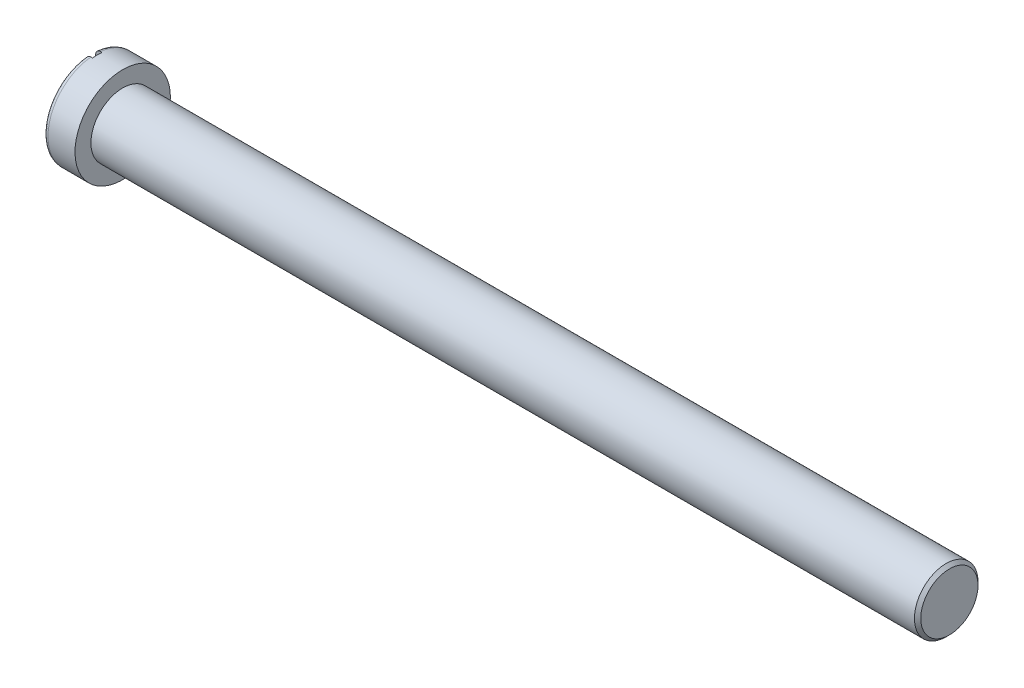
from build123d import *

# Parameters (mm, degrees)
SKETCH1_R           = 15
SKETCH1_R_2         = 10
BOSS_EXTRUDE1_DEPTH = 10
SKETCH1_2_R         = 10
BOSS_EXTRUDE2_DEPTH = 270
CHAMFER1_SIZE       = 1
FILLET1_R           = 1.5
SKETCH2_W           = 3
SKETCH2_H           = 32.549334764
CUT_EXTRUDE1_DEPTH  = 2


with BuildPart() as part:
    # Sketch1 → Boss-Extrude1 (new body)
    with BuildSketch(Plane(origin=(0, 0, 0), x_dir=(0, 0, -1), z_dir=(1, 0, 0))):
        Circle(SKETCH1_R)
        Circle(SKETCH1_R_2, mode=Mode.SUBTRACT)
    extrude(amount=BOSS_EXTRUDE1_DEPTH)

    # Sketch1<2> → Boss-Extrude2 (add)
    with BuildSketch(Plane(origin=(0, 0, 0), x_dir=(0, 0, -1), z_dir=(1, 0, 0))):
        Circle(SKETCH1_2_R)
    extrude(amount=BOSS_EXTRUDE2_DEPTH)

    # Chamfer1
    chamfer1_edges = [part.edges().sort_by_distance(p)[0] for p in [
        (270, 0, 10),
    ]]
    chamfer(chamfer1_edges, length=CHAMFER1_SIZE)

    # Fillet1
    fillet1_edges = [part.edges().sort_by_distance(p)[0] for p in [
        (0, 0, 15),
    ]]
    fillet(fillet1_edges, radius=FILLET1_R)

    # Sketch2 → Cut-Extrude1 (cut)
    with BuildSketch(Plane.ZY):
        Rectangle(SKETCH2_W, SKETCH2_H)
    extrude(amount=-CUT_EXTRUDE1_DEPTH, mode=Mode.SUBTRACT)


solid = part.part
